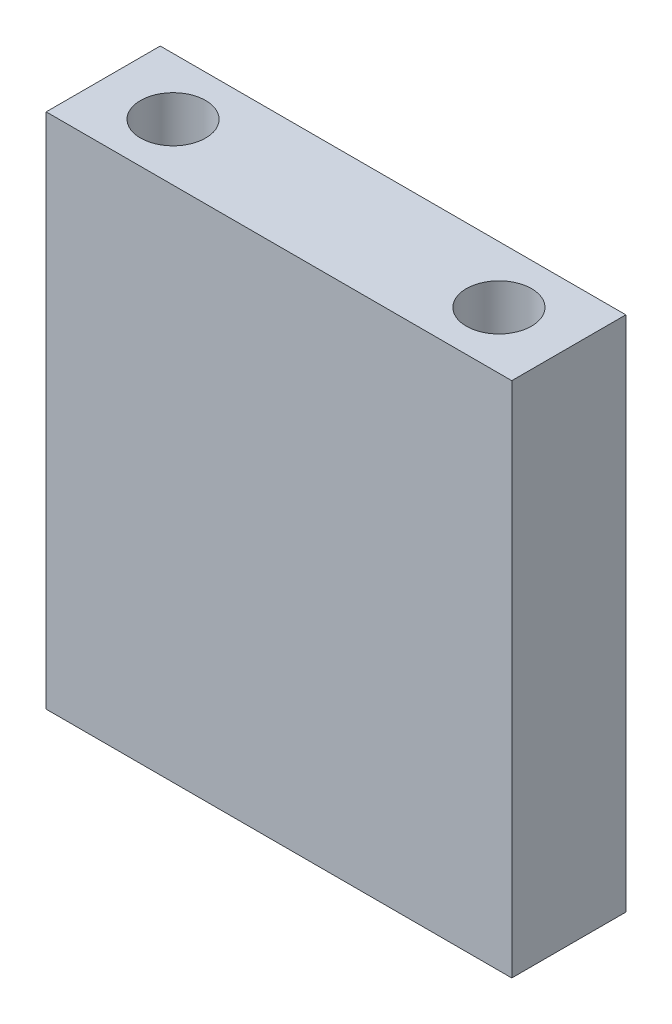
from build123d import *

# Parameters (mm, degrees)
SKETCH1_W           = 28.575
SKETCH1_H           = 31.75
BOSS_EXTRUDE1_DEPTH = 3.5
SKETCH3_R           = 2
CUT_EXTRUDE1_DEPTH  = 6


with BuildPart() as part:
    # Sketch1 → Boss-Extrude1 (new, symmetric)
    with BuildSketch(Plane.XY):
        Rectangle(SKETCH1_W, SKETCH1_H)
    extrude(amount=BOSS_EXTRUDE1_DEPTH, both=True)

    # Sketch3 → Cut-Extrude1 (cut)
    with BuildSketch(Plane(origin=(0, 15.875, 0), x_dir=(1, 0, 0), z_dir=(0, 1, 0))):
        with Locations(Location((-10, 0, 0), (0, 0, 270))):
            Circle(SKETCH3_R)
        with Locations(Location((10, 0, 0), (0, 0, 90))):
            Circle(SKETCH3_R)
    extrude(amount=-CUT_EXTRUDE1_DEPTH, mode=Mode.SUBTRACT)


solid = part.part
